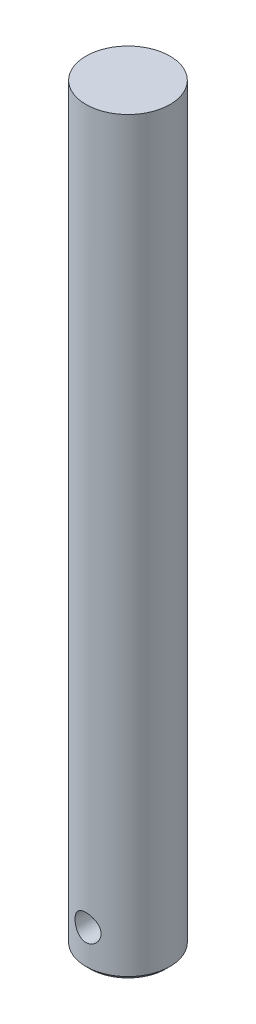
from build123d import *

# Parameters (mm, degrees)
SKETCH1_R           = 10
BOSS_EXTRUDE1_DEPTH = 178.8
CHAMFER1_SIZE       = 1
SKETCH2_R           = 3.1
CUT_EXTRUDE1_DEPTH  = 155
SKETCH_1_R          = 2.5
CUT_EXTRUDE_1_DEPTH = 10


with BuildPart() as part:
    # Sketch1 → Boss-Extrude1 (new body)
    with BuildSketch(Plane(origin=(0, 0, 0), x_dir=(1, 0, 0), z_dir=(0, 1, 0))):
        with Locations(Location((0, 0, 0), (0, 0, 90))):
            Circle(SKETCH1_R)
    extrude(amount=BOSS_EXTRUDE1_DEPTH)

    # Chamfer1
    chamfer1_edges = [part.edges().sort_by_distance(p)[0] for p in [
        (0, 0, 10),
    ]]
    chamfer(chamfer1_edges, length=CHAMFER1_SIZE)

    # Sketch2 → Cut-Extrude1 (cut)
    with BuildSketch(Plane(origin=(0, 0, -10), x_dir=(-1, 0, 0), z_dir=(0, 0, -1))):
        with Locations((0, 9.05)):
            Circle(SKETCH2_R)
    extrude(amount=-CUT_EXTRUDE1_DEPTH, mode=Mode.SUBTRACT)

    # 草图1 → 切除-拉伸1 (cut)
    with BuildSketch(Plane.XZ):
        with Locations(Location((0, 0, 0), (0, 0, 270))):
            Circle(SKETCH_1_R)
    extrude(amount=-CUT_EXTRUDE_1_DEPTH, mode=Mode.SUBTRACT)


solid = part.part
